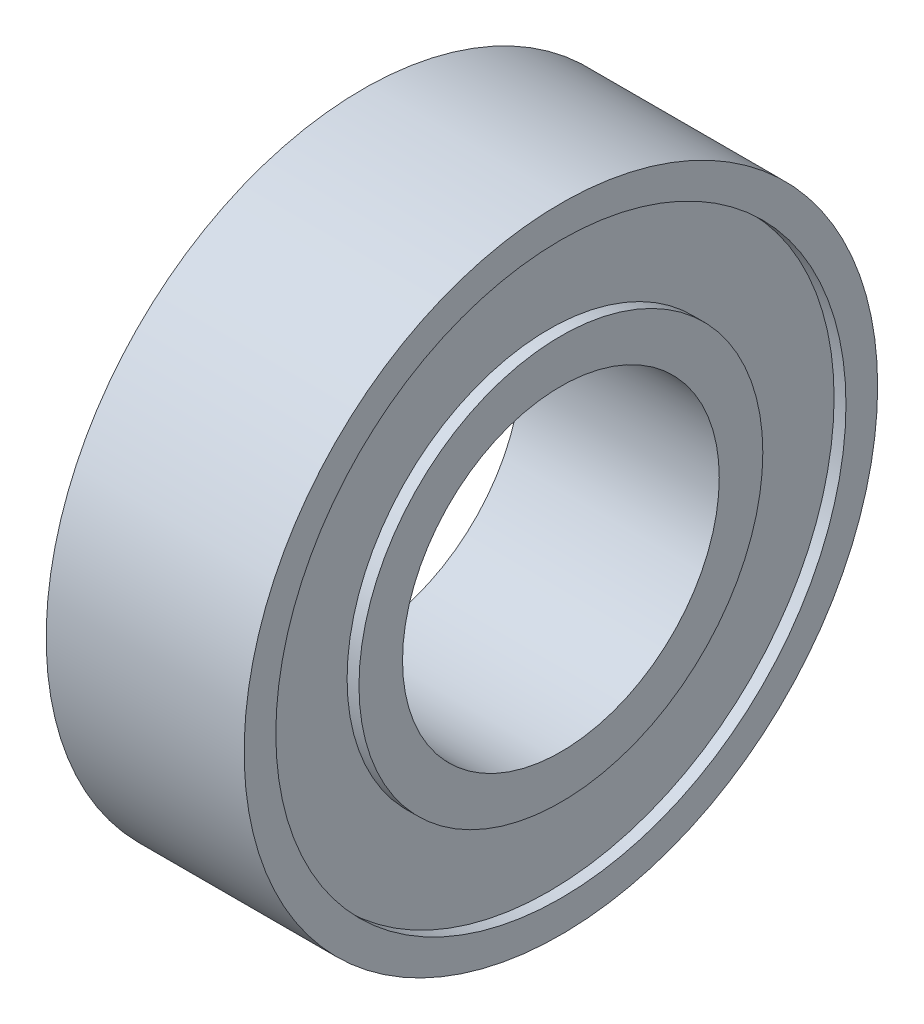
from build123d import *


with BuildPart() as part:
    # Sketch1 → Revolve1 (revolve)
    with BuildSketch(Plane.XY, mode=Mode.PRIVATE) as revolve1_sk:
        Polygon((2.5, 4), (-2.5, 4), (-2.5, 5.1), (-2.2, 5.1), (-2.2, 7.2), (-2.5, 7.2), (-2.5, 8), (2.5, 8), (2.5, 7.2), (2.2, 7.2), (2.2, 5.1), (2.5, 5.1), align=None)
    revolve(revolve1_sk.sketch.rotate(Axis((0, 0, 0), (-1, 0, 0)), 90), axis=Axis((0, 0, 0), (-1, 0, 0)))


solid = part.part
